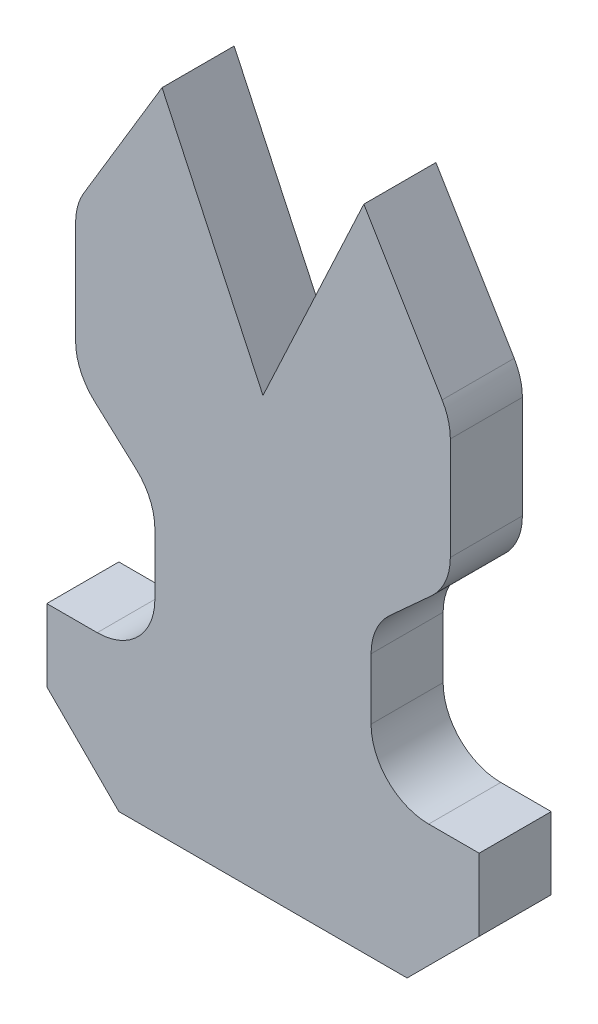
from build123d import *

# Parameters (mm, degrees)
ESTRUSIONE_ESTRUSIONE1_DEPTH = 0.5


with BuildPart() as part:
    # Schizzo1 → Estrusione-Estrusione1 (new body)
    with BuildSketch(Plane.XY):
        with BuildLine():
            Line((-1, -3), (1, -3))
            Line((1, -3), (1.5, -2.5))
            Line((1.5, -2.5), (1.5, -2))
            Line((1.5, -2), (1.15, -2))
            ThreePointArc((1.15, -2), (0.867157288, -1.882842712), (0.75, -1.6))
            Line((0.75, -1.6), (0.75, -1.176947954))
            ThreePointArc((0.75, -1.176947954), (0.784194282, -1.015126521), (0.880930882, -0.880971925))
            Line((0.880930882, -0.880971925), (1.169069118, -0.619028075))
            ThreePointArc((1.169069118, -0.619028075), (1.265805718, -0.484873479), (1.3, -0.323052046))
            Line((1.3, -0.323052046), (1.3, 0.389206414))
            ThreePointArc((1.3, 0.389206414), (1.285485971, 0.495979847), (1.24299717, 0.595004716))
            Line((1.24299717, 0.595004716), (0.7, 1.5))
            Line((0.7, 1.5), (0, 0))
            Line((0, 0), (-0.7, 1.5))
            Line((-0.7, 1.5), (-1.24299717, 0.595004716))
            ThreePointArc((-1.24299717, 0.595004716), (-1.285485971, 0.495979847), (-1.3, 0.389206414))
            Line((-1.3, 0.389206414), (-1.3, -0.323052046))
            ThreePointArc((-1.3, -0.323052046), (-1.265805718, -0.484873479), (-1.169069118, -0.619028075))
            Line((-1.169069118, -0.619028075), (-0.880930882, -0.880971925))
            ThreePointArc((-0.880930882, -0.880971925), (-0.784194282, -1.015126521), (-0.75, -1.176947954))
            Line((-0.75, -1.176947954), (-0.75, -1.6))
            ThreePointArc((-0.75, -1.6), (-0.867157288, -1.882842712), (-1.15, -2))
            Line((-1.15, -2), (-1.5, -2))
            Line((-1.5, -2), (-1.5, -2.5))
            Line((-1.5, -2.5), (-1, -3))
        make_face()
    extrude(amount=ESTRUSIONE_ESTRUSIONE1_DEPTH)


solid = part.part
